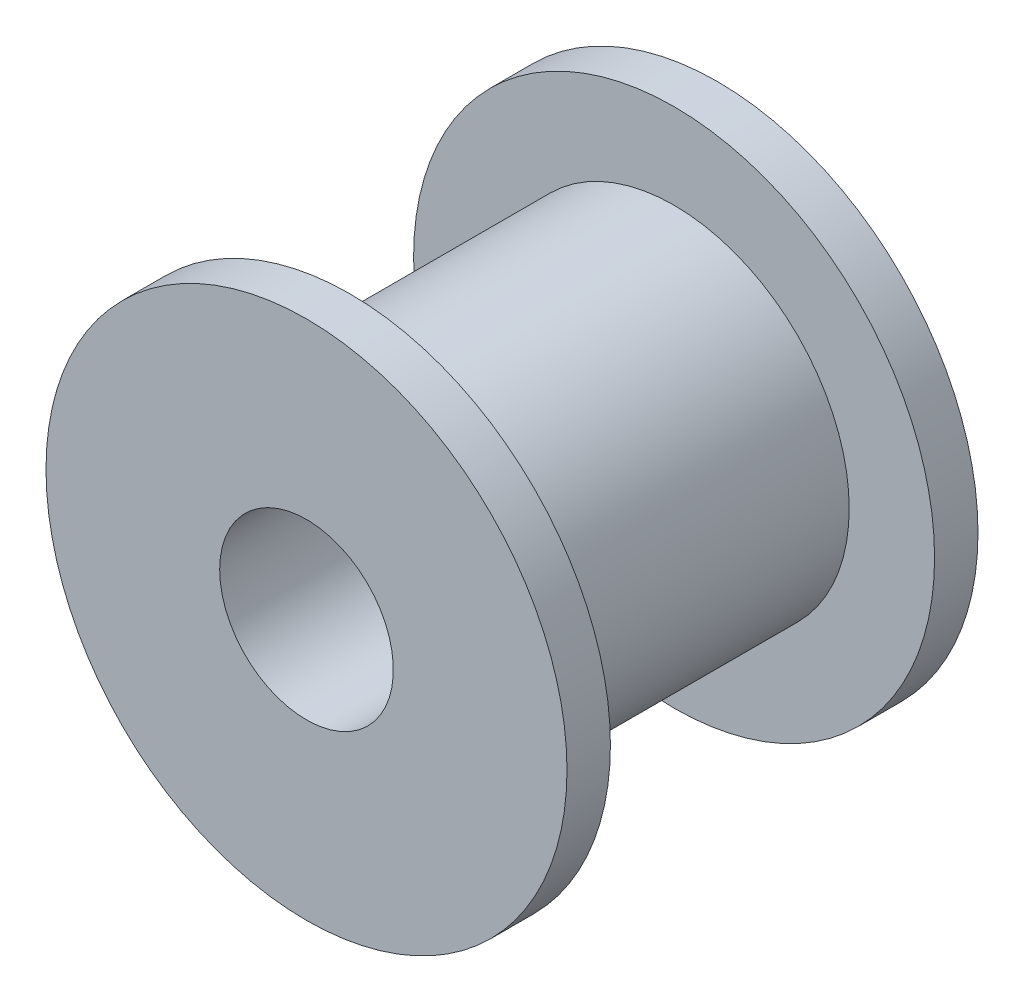
from build123d import *


with BuildPart() as part:
    # Sketch1 → Revolve1 (revolve)
    with BuildSketch(Plane(origin=(0, 0, 0), x_dir=(1, 0, 0), z_dir=(0, 1, 0)), mode=Mode.PRIVATE) as revolve1_sk:
        Polygon((3, -7.1), (3, 7.1), (9, 7.1), (9, 5.6), (6.05, 5.6), (6.05, 0), (6.05, -5.6), (9, -5.6), (9, -7.1), align=None)
    revolve(revolve1_sk.sketch.rotate(Axis((0, 0, -16.267080745), (0, 0, 1)), 180), axis=Axis((0, 0, -16.267080745), (0, 0, 1)))


solid = part.part
